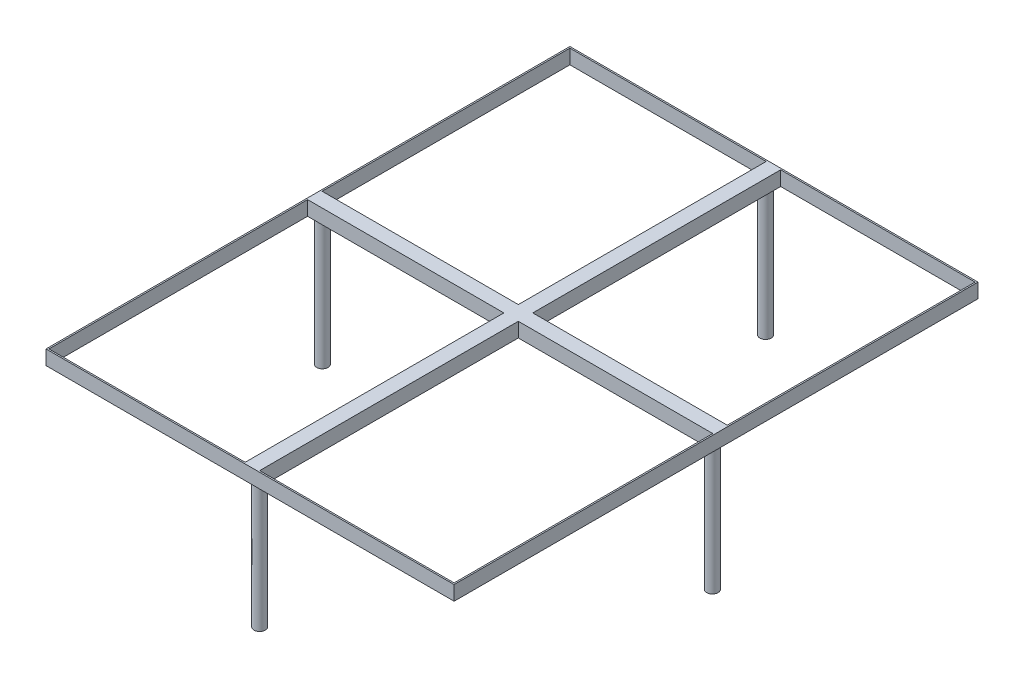
from build123d import *

# Parameters (mm, degrees)
CROQUIS1_W              = 564
CROQUIS1_H              = 724
CROQUIS1_W_2            = 560
CROQUIS1_H_2            = 720
SALIENTE_EXTRUIR1_DEPTH = 20
CROQUIS2_W              = 20
CROQUIS2_H              = 357.467498219
CROQUIS2_W_2            = 271.273547015
CROQUIS2_H_2            = 20
CROQUIS2_W_3            = 268.726452985
CROQUIS2_H_3            = 342.532501781
SALIENTE_EXTRUIR4_DEPTH = 20
CROQUIS4_R              = 7.807995064
SALIENTE_EXTRUIR5_DEPTH = 177


with BuildPart() as part:
    # Croquis1 → Saliente-Extruir1 (new body)
    with BuildSketch(Plane(origin=(0, 0, 0), x_dir=(1, 0, 0), z_dir=(0, 1, 0))):
        with Locations((10.666666667, -90.666666667)):
            Rectangle(CROQUIS1_W, CROQUIS1_H)
        with Locations((10.666666667, -90.666666667)):
            Rectangle(CROQUIS1_W_2, CROQUIS1_H_2, mode=Mode.SUBTRACT)
    extrude(amount=SALIENTE_EXTRUIR1_DEPTH)

    # Croquis2 → Saliente-Extruir4 (add)
    with BuildSketch(Plane(origin=(0, 20, 0), x_dir=(1, 0, 0), z_dir=(0, 1, 0))):
        with Locations((11.940213682, -271.932917557)):
            Rectangle(CROQUIS2_W, CROQUIS2_H)
        with Locations((-133.696559826, -83.199168448)):
            Rectangle(CROQUIS2_W_2, CROQUIS2_H_2)
        with Locations((156.303440174, -83.199168448)):
            Rectangle(CROQUIS2_W_3, CROQUIS2_H_2)
        with Locations((11.940213682, 98.067082443)):
            Rectangle(CROQUIS2_W, CROQUIS2_H_3)
        with Locations((11.940213682, -83.199168448)):
            Rectangle(CROQUIS2_W, CROQUIS2_H_2)
    extrude(amount=-SALIENTE_EXTRUIR4_DEPTH)

    # Croquis4 → Saliente-Extruir5 (add)
    with BuildSketch(Plane.XZ):
        with Locations(Location((279.95622774, 83.01742746, 0), (0, 0, 90))):
            Circle(CROQUIS4_R)
        with Locations(Location((12.04565938, 440.740646454, 0), (0, 0, 90))):
            Circle(CROQUIS4_R)
        with Locations(Location((12.04565938, -258.363567648, 0), (0, 0, 90))):
            Circle(CROQUIS4_R)
        with Locations(Location((-258.982651015, 83.01742746, 0), (0, 0, 90))):
            Circle(CROQUIS4_R)
    extrude(amount=SALIENTE_EXTRUIR5_DEPTH)


solid = part.part
